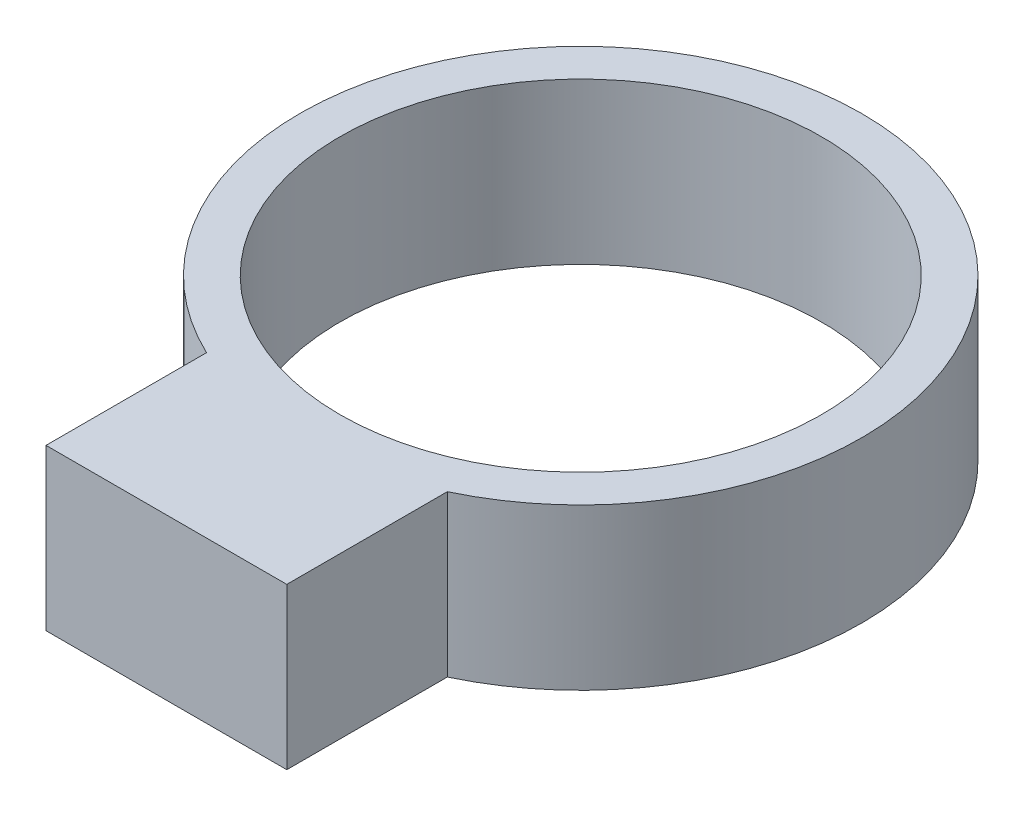
from build123d import *

# Parameters (mm, degrees)
SKETCH1_R           = 15
BOSS_EXTRUDE1_DEPTH = 10


with BuildPart() as part:
    # Sketch1 → Boss-Extrude1 (new body)
    with BuildSketch(Plane(origin=(0, 0, 0), x_dir=(1, 0, 0), z_dir=(0, 1, 0))):
        with BuildLine():
            Line((-7.5, -25.811388301), (7.5, -25.811388301))
            Line((7.5, -25.811388301), (7.5, -15.811388301))
            ThreePointArc((7.5, -15.811388301), (0, 17.5), (-7.5, -15.811388301))
            Line((-7.5, -15.811388301), (-7.5, -25.811388301))
        make_face()
        with Locations(Location((0, 0, 0), (0, 0, 270))):
            Circle(SKETCH1_R, mode=Mode.SUBTRACT)
    extrude(amount=BOSS_EXTRUDE1_DEPTH)


solid = part.part
